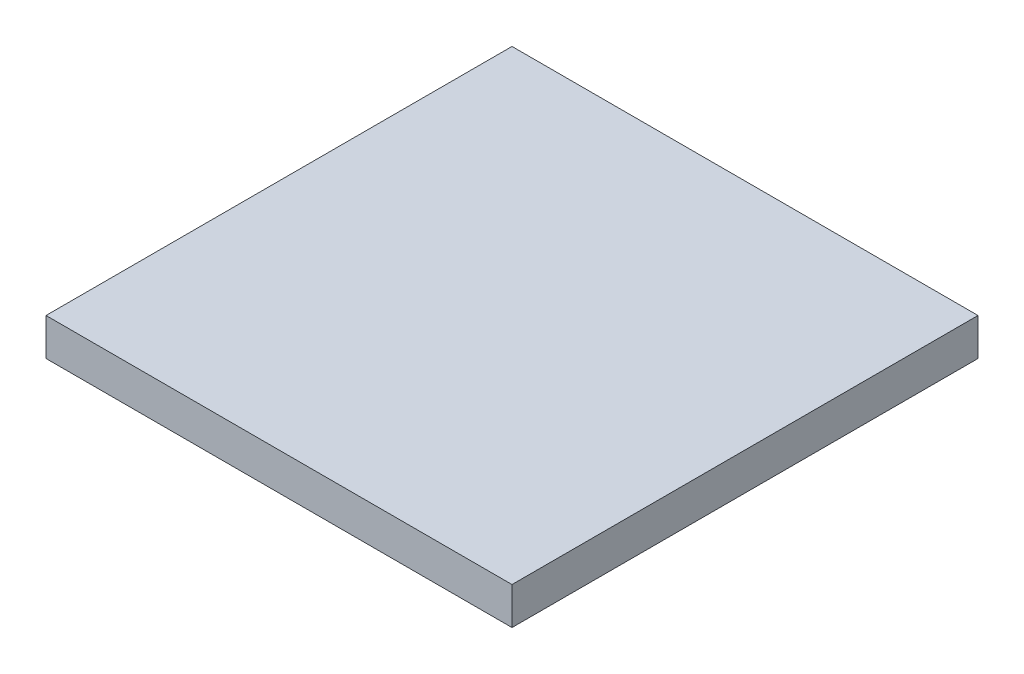
from build123d import *

# Parameters (mm, degrees)
SKETCH1_W           = 37.5
SKETCH1_H           = 37.5
BOSS_EXTRUDE1_DEPTH = 3


with BuildPart() as part:
    # Sketch1 → Boss-Extrude1 (new body)
    with BuildSketch(Plane(origin=(0, 0, 0), x_dir=(1, 0, 0), z_dir=(0, 1, 0))):
        with Locations((18.75, 18.75)):
            Rectangle(SKETCH1_W, SKETCH1_H)
    extrude(amount=BOSS_EXTRUDE1_DEPTH)


solid = part.part
